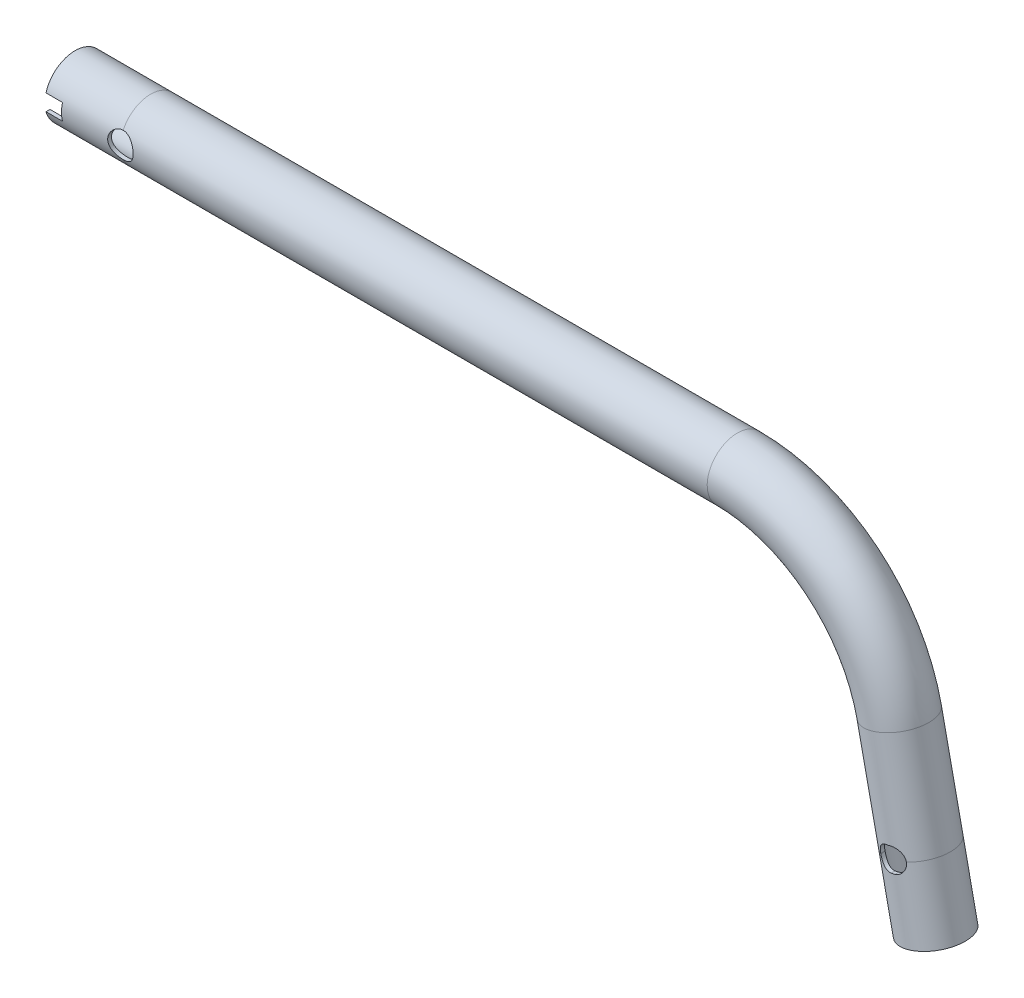
from build123d import *

# Parameters (mm, degrees)
SKETCH2_R                      = 9.5
SKETCH2_R_2                    = 8.3
CUT_EXTRUDE1_REACH             = 275.888
CUT_EXTRUDE1_DIRECTION_2_REACH = 275.888
CUT_EXTRUDE2_REACH             = 275.888
CUT_EXTRUDE2_END_RADIUS        = 9.5
SKETCH4_R                      = 4
CUT_EXTRUDE3_DEPTH             = 274.887531588
CUT_EXTRUDE3_DEPTH_BACK        = 274.887531588


with BuildPart() as part:
    # Sweep1: sweep along a path in Sketch1
    with BuildLine(Plane.XY) as sweep1_path:
        Line((-23.723755643, 0), (0, 0))
        Line((0, 0), (184.374601272, 0))
        ThreePointArc((184.374601272, 0), (217.099261607, -11.588410004), (235.23827651, -41.188592077))
        Line((235.23827651, -41.188592077), (242, -73))
        Line((242, -73), (246.676244357, -95))
    # Sketch2 → Sweep1 (sweep)
    with BuildSketch(Plane.ZY.offset(23.723755643)):
        Circle(SKETCH2_R)
        Circle(SKETCH2_R_2, mode=Mode.SUBTRACT)
    sweep(path=sweep1_path.line)

    # Sketch3 → Cut-Extrude1 (cut, up to next)
    with BuildSketch(Plane.XY, mode=Mode.PRIVATE) as cut_extrude1_sk1:
        with BuildLine():
            Line((246.027778512, -72.229297246), (245.993031815, -72.065826889))
            ThreePointArc((245.993031815, -72.065826889), (244.475751834, -69.858170819), (241.841824294, -69.370001204))
            Line((241.841824294, -69.370001204), (240.668047173, -69.619495233))
            ThreePointArc((240.668047173, -69.619495233), (238.460391103, -71.136775213), (237.972221488, -73.770702754))
            Line((237.972221488, -73.770702754), (238.006968185, -73.934173111))
            ThreePointArc((238.006968185, -73.934173111), (239.524248166, -76.141829181), (242.158175706, -76.629998796))
            Line((242.158175706, -76.629998796), (243.331952827, -76.380504767))
            ThreePointArc((243.331952827, -76.380504767), (245.539608897, -74.863224787), (246.027778512, -72.229297246))
        make_face()
    cut_extrude1_tool1 = extrude(cut_extrude1_sk1.sketch, amount=-CUT_EXTRUDE1_REACH, mode=Mode.PRIVATE) & part.part
    add(cut_extrude1_tool1.solids().sort_by_distance((242, -73, 0))[0], mode=Mode.SUBTRACT)

    # Sketch3 → Cut-Extrude1 direction 2 (cut, up to next)
    with BuildSketch(Plane.XY, mode=Mode.PRIVATE) as cut_extrude1_direction_2_sk1:
        with BuildLine():
            Line((246.027778512, -72.229297246), (245.993031815, -72.065826889))
            ThreePointArc((245.993031815, -72.065826889), (244.475751834, -69.858170819), (241.841824294, -69.370001204))
            Line((241.841824294, -69.370001204), (240.668047173, -69.619495233))
            ThreePointArc((240.668047173, -69.619495233), (238.460391103, -71.136775213), (237.972221488, -73.770702754))
            Line((237.972221488, -73.770702754), (238.006968185, -73.934173111))
            ThreePointArc((238.006968185, -73.934173111), (239.524248166, -76.141829181), (242.158175706, -76.629998796))
            Line((242.158175706, -76.629998796), (243.331952827, -76.380504767))
            ThreePointArc((243.331952827, -76.380504767), (245.539608897, -74.863224787), (246.027778512, -72.229297246))
        make_face()
    cut_extrude1_direction_2_tool1 = extrude(cut_extrude1_direction_2_sk1.sketch, amount=CUT_EXTRUDE1_DIRECTION_2_REACH, mode=Mode.PRIVATE) & part.part
    add(cut_extrude1_direction_2_tool1.solids().sort_by_distance((242, -73, 0))[0], mode=Mode.SUBTRACT)

    # Cut-Extrude2: up to this cylinder (the profile starts inside it)
    cut_extrude2_end = Plane(origin=(0, 0, 0), z_dir=(-1, 0, 0)) * Cylinder(CUT_EXTRUDE2_END_RADIUS, 571.776, mode=Mode.PRIVATE)
    # Sketch4 → Cut-Extrude2 (cut, up to the surface)
    with BuildSketch(Plane.XY, mode=Mode.PRIVATE) as cut_extrude2_sk1:
        with Locations(Location((0, 0, 0), (0, 0, 90))):
            Circle(SKETCH4_R)
    cut_extrude2_tool1 = extrude(cut_extrude2_sk1.sketch, amount=CUT_EXTRUDE2_REACH, mode=Mode.PRIVATE) & cut_extrude2_end
    add(cut_extrude2_tool1.solids().sort_by_distance((0, 0, 0))[0], mode=Mode.SUBTRACT)

    # Sketch5 → Cut-Extrude3 (cut, two sides: drawn at the far end of the back side and taken through both)
    with BuildSketch(Plane.XY.offset(-CUT_EXTRUDE3_DEPTH_BACK)):
        Polygon((-23.723755643, 0), (-23.723755643, 2.555), (-18.523755643, 2.555), (-18.523755643, -2.555), (-23.723755643, -2.555), align=None)
    extrude(amount=CUT_EXTRUDE3_DEPTH + CUT_EXTRUDE3_DEPTH_BACK, mode=Mode.SUBTRACT)


solid = part.part
